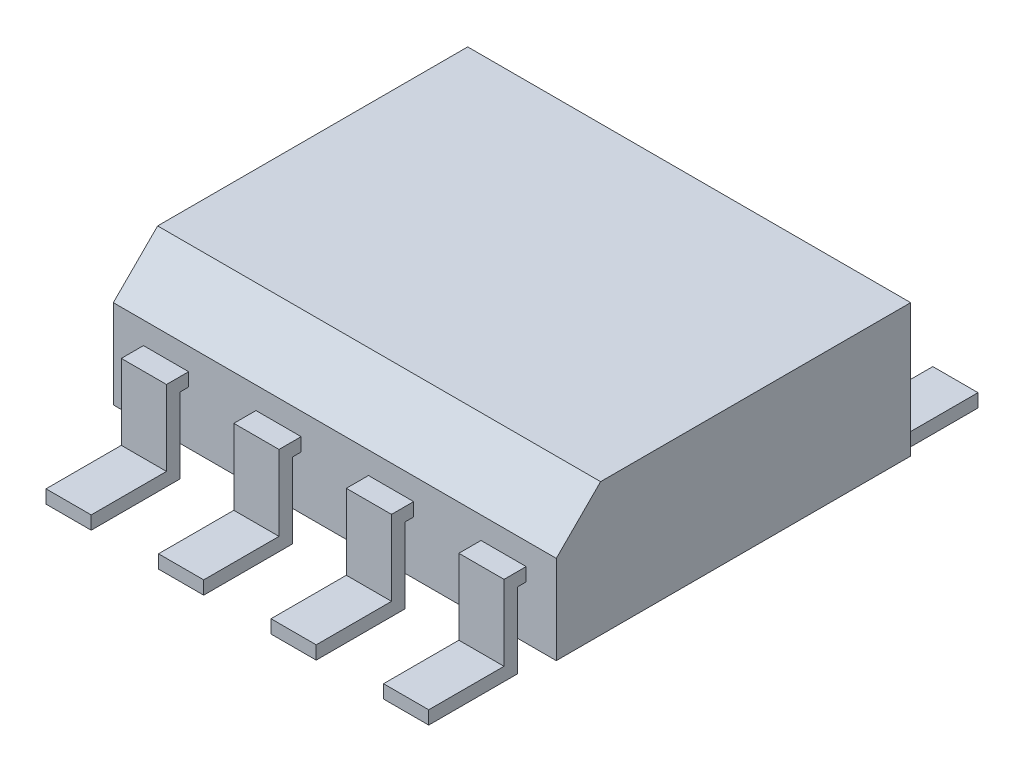
from build123d import *

# Parameters (mm, degrees)
SKETCH_1_W          = 5
SKETCH_1_H          = 4
EXTRUDE_1_DEPTH     = 1.5
CHAMFER_1_SIZE      = 0.5
EXTRUDE_2_DEPTH     = 5
SKETCH_3_W          = 0.34
SKETCH_3_H          = 1.1
SKETCH_3_W_2        = 0.76
CUT_EXTRUDE_1_DEPTH = 5.35


with BuildPart() as part:
    # Эскиз1 → Бобышка-Вытянуть1 (new body)
    with BuildSketch(Plane(origin=(0, 0, 0), x_dir=(1, 0, 0), z_dir=(0, 1, 0))):
        Rectangle(SKETCH_1_W, SKETCH_1_H)
    extrude(amount=EXTRUDE_1_DEPTH)

    # Фаска1
    chamfer_1_edges = [part.edges().sort_by_distance(p)[0] for p in [
        (0, 1.5, 2),
    ]]
    chamfer(chamfer_1_edges, length=CHAMFER_1_SIZE)

    # Эскиз2 → Бобышка-Вытянуть2 (add, through all)
    with BuildSketch(Plane(origin=(2.5, 0, 0), x_dir=(0, 0, -1), z_dir=(1, 0, 0))):
        Polygon((-2, 0.75), (-2.25, 0.75), (-2.25, -0.1), (-3.1, -0.1), (-3.1, -0.25), (-2.1, -0.25), (-2.1, 0.6), (0, 0.6), (0, 0.75), align=None)
    extrude_2 = extrude(amount=-EXTRUDE_2_DEPTH)

    # Эскиз3 → Вырез-Вытянуть1 (cut, through all)
    with BuildSketch(Plane(origin=(0, 1.5, 0), x_dir=(1, 0, 0), z_dir=(0, 1, 0))):
        with Locations((-2.33, -2.55)):
            Rectangle(SKETCH_3_W, SKETCH_3_H)
        with Locations((-1.27, -2.55)):
            Rectangle(SKETCH_3_W_2, SKETCH_3_H)
        with Locations((0, -2.55)):
            Rectangle(SKETCH_3_W_2, SKETCH_3_H)
        with Locations((1.27, -2.55)):
            Rectangle(SKETCH_3_W_2, SKETCH_3_H)
        with Locations((2.33, -2.55)):
            Rectangle(SKETCH_3_W, SKETCH_3_H)
    cut_extrude_1 = extrude(amount=-CUT_EXTRUDE_1_DEPTH, mode=Mode.SUBTRACT)

    # Зеркальное отражение1: Бобышка-Вытянуть2, Вырез-Вытянуть1 across plane
    add(extrude_2.mirror(Plane.XY))
    add(cut_extrude_1.mirror(Plane.XY), mode=Mode.SUBTRACT)


solid = part.part
